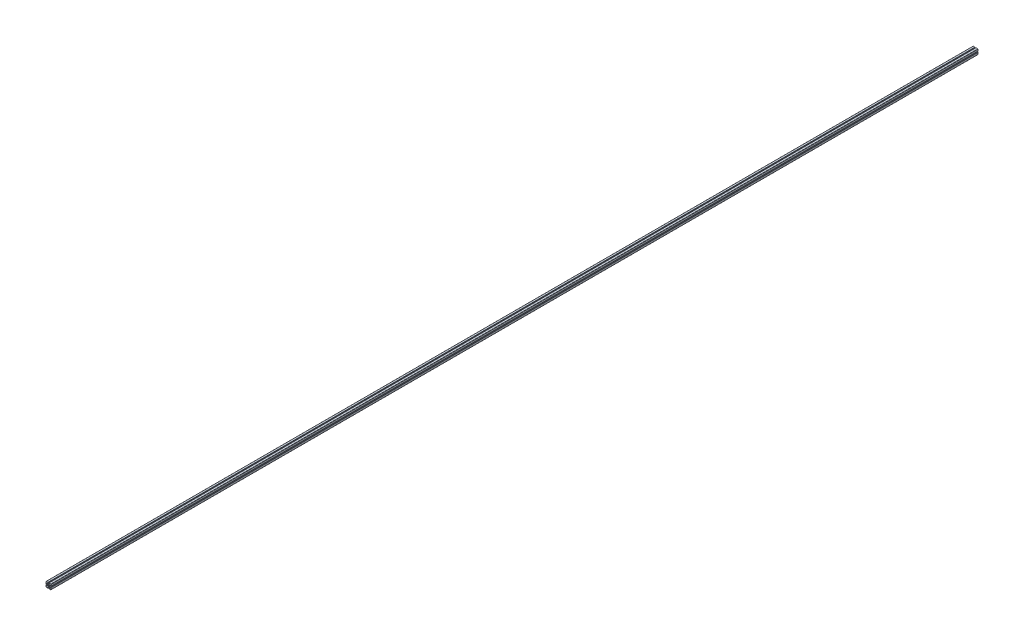
from build123d import *

# Parameters (mm, degrees)
SKETCH_1_W               = 40
SKETCH_1_H               = 40
EXTRUDE_1_DEPTH          = 7420
SKETCH_2_R               = 4.05
CUT_EXTRUDE_1_DEPTH      = 10000
CUT_EXTRUDE_2_DEPTH      = 10000
FILLET_1_R               = 1
PATTERN_CIRCULAR_2_COUNT = 4
FILLET_2_R               = 1
FILLET_3_R               = 1
FILLET_4_R               = 1
FILLET_5_R               = 2


with BuildPart() as part:
    # 草图1 → 凸台-拉伸1 (new body)
    with BuildSketch(Plane.XY):
        Rectangle(SKETCH_1_W, SKETCH_1_H)
    extrude(amount=EXTRUDE_1_DEPTH)

    # 草图2 → 切除-拉伸1 (cut)
    with BuildSketch(Plane.XY.offset(7420)):
        Circle(SKETCH_2_R)
    extrude(amount=-CUT_EXTRUDE_1_DEPTH, mode=Mode.SUBTRACT)

    # 草图4 → 切除-拉伸2 (cut)
    with BuildSketch(Plane.XY.offset(7420)):
        Polygon((20, 0), (20, 4), (16, 4), (16, 10.5), (7.876860985, 2.6), (7.876860985, -2.6), (16, -10.5), (16, -2.65197969), (20, -2.65197969), align=None)
    cut_extrude_2 = extrude(amount=-CUT_EXTRUDE_2_DEPTH, mode=Mode.SUBTRACT)

    # 圆角1
    fillet_1_edges = [part.edges().sort_by_distance(p)[0] for p in [
        (20, -2.65197969, 3710),
        (16, -2.65197969, 3710),
        (16, -10.5, 3710),
        (7.876860985, -2.6, 3710),
        (7.876860985, 2.6, 3710),
        (16, 10.5, 3710),
        (16, 4, 3710),
        (20, 4, 3710),
    ]]
    fillet(fillet_1_edges, radius=FILLET_1_R)

    # 阵列(圆周)2: 切除-拉伸2 ×4 about axis
    pattern_circular_2_axis = Axis((0, 0, 0), (0, 0, 1))
    for i in range(1, PATTERN_CIRCULAR_2_COUNT):
        add(cut_extrude_2.rotate(pattern_circular_2_axis, i * 360 / PATTERN_CIRCULAR_2_COUNT), mode=Mode.SUBTRACT)

    # 圆角2
    fillet_2_edges = [part.edges().sort_by_distance(p)[0] for p in [
        (2.65197969, 20, 3710),
        (2.65197969, 16, 3710),
        (10.5, 16, 3710),
        (2.6, 7.876860985, 3710),
        (-2.6, 7.876860985, 3710),
        (-10.5, 16, 3710),
        (-4, 16, 3710),
        (-4, 20, 3710),
    ]]
    fillet(fillet_2_edges, radius=FILLET_2_R)

    # 圆角3
    fillet_3_edges = [part.edges().sort_by_distance(p)[0] for p in [
        (-20, 2.65197969, 3710),
        (-16, 2.65197969, 3710),
        (-16, 10.5, 3710),
        (-7.876860985, 2.6, 3710),
        (-7.876860985, -2.6, 3710),
        (-16, -10.5, 3710),
        (-16, -4, 3710),
        (-20, -4, 3710),
    ]]
    fillet(fillet_3_edges, radius=FILLET_3_R)

    # 圆角4
    fillet_4_edges = [part.edges().sort_by_distance(p)[0] for p in [
        (-2.65197969, -20, 3710),
        (-2.65197969, -16, 3710),
        (-10.5, -16, 3710),
        (-2.6, -7.876860985, 3710),
        (2.6, -7.876860985, 3710),
        (10.5, -16, 3710),
        (4, -16, 3710),
        (4, -20, 3710),
    ]]
    fillet(fillet_4_edges, radius=FILLET_4_R)

    # 圆角5
    fillet_5_edges = [part.edges().sort_by_distance(p)[0] for p in [
        (20, -20, 3710),
        (-20, -20, 3710),
        (-20, 20, 3710),
        (20, 20, 3710),
    ]]
    fillet(fillet_5_edges, radius=FILLET_5_R)


solid = part.part
